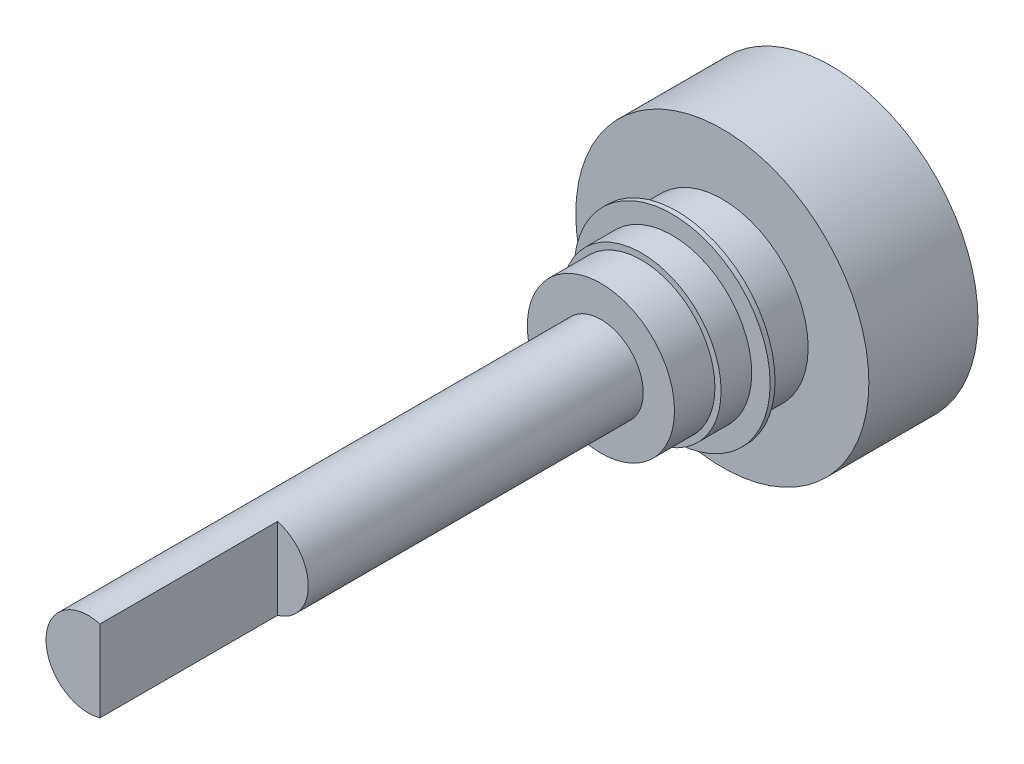
from build123d import *

# Parameters (mm, degrees)
SKETCH2_R           = 11.95
BOSS_EXTRUDE1_DEPTH = 8.9
SKETCH3_R           = 7
BOSS_EXTRUDE2_DEPTH = 3.7
SKETCH5_R           = 8
BOSS_EXTRUDE3_DEPTH = 0.4
SKETCH6_R           = 6.5
BOSS_EXTRUDE4_DEPTH = 2.5
SKETCH7_R           = 6
BOSS_EXTRUDE5_DEPTH = 3.3
SKETCH8_R           = 3.45
BOSS_EXTRUDE6_DEPTH = 41.8
CUT_EXTRUDE2_START  = -14.49
CUT_EXTRUDE2_DEPTH  = 14.49


with BuildPart() as part:
    # Sketch2 → Boss-Extrude1 (new body)
    with BuildSketch(Plane(origin=(0, 0, 0), x_dir=(0, 1, 0), z_dir=(0, 0, 1))):
        with Locations(Location((0, 0, 0), (0, 0, 270))):
            Circle(SKETCH2_R)
    extrude(amount=BOSS_EXTRUDE1_DEPTH)

    # Sketch3 → Boss-Extrude2 (add)
    with BuildSketch(Plane.XY.offset(8.9)):
        Circle(SKETCH3_R)
    extrude(amount=BOSS_EXTRUDE2_DEPTH)

    # Sketch5 → Boss-Extrude3 (add)
    with BuildSketch(Plane.XY.offset(12.6)):
        Circle(SKETCH5_R)
    extrude(amount=BOSS_EXTRUDE3_DEPTH)

    # Sketch6 → Boss-Extrude4 (add)
    with BuildSketch(Plane.XY.offset(13)):
        Circle(SKETCH6_R)
    extrude(amount=BOSS_EXTRUDE4_DEPTH)

    # Sketch7 → Boss-Extrude5 (add)
    with BuildSketch(Plane.XY.offset(15.5)):
        Circle(SKETCH7_R)
    extrude(amount=BOSS_EXTRUDE5_DEPTH)

    # Sketch8 → Boss-Extrude6 (add)
    with BuildSketch(Plane.XY.offset(18.8)):
        Circle(SKETCH8_R)
    extrude(amount=BOSS_EXTRUDE6_DEPTH)

    # Sketch10 → Cut-Extrude2 (cut)
    with BuildSketch(Plane.XY.offset(60.6).offset(CUT_EXTRUDE2_START)):
        with BuildLine():
            Line((0.95, 3.31662479), (0.95, -3.31662479))
            ThreePointArc((0.95, -3.31662479), (3.45, 0), (0.95, 3.31662479))
        make_face()
    extrude(amount=CUT_EXTRUDE2_DEPTH, mode=Mode.SUBTRACT)


solid = part.part
